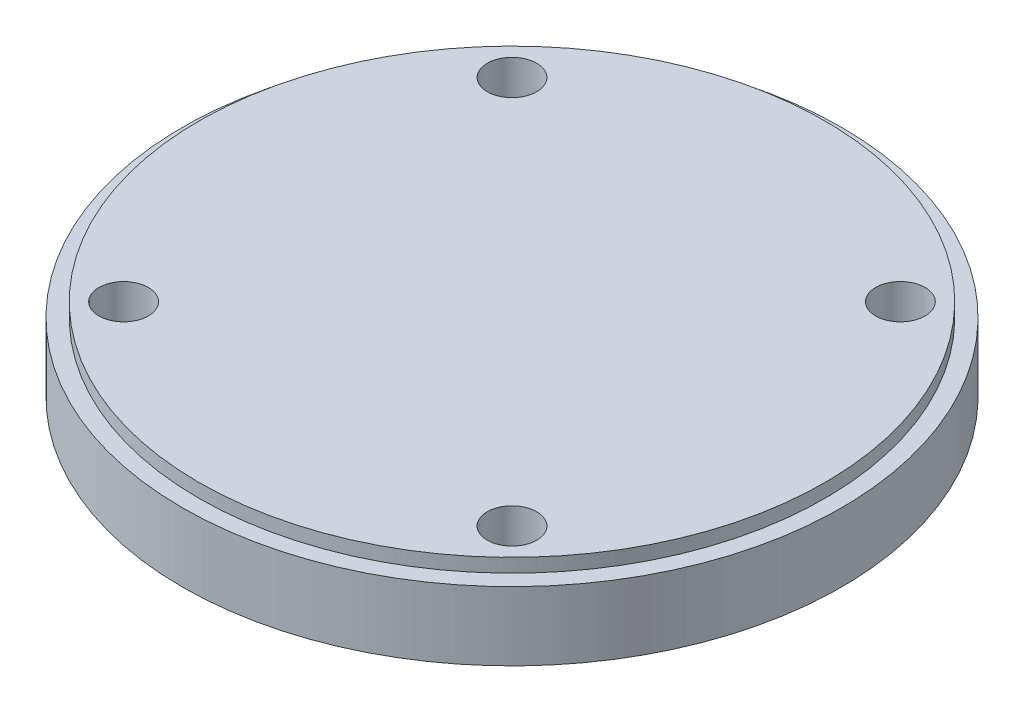
from build123d import *

# Parameters (mm, degrees)
SKETCH1_R            = 57
EXTRUDE4_DEPTH       = 7.5
EXTRUDE5_DEPTH       = 5
EXTRUDE5_DEPTH_BACK  = 7.5
SKETCH_R             = 60
SKETCH_R_2           = 57
M8_CLEARANCE_HOLE3_D = 9
CIRPATTERN1_COUNT    = 4


with BuildPart() as part:
    # Sketch1 → Extrude4 (new, symmetric)
    with BuildSketch(Plane(origin=(0, 0, 0), x_dir=(1, 0, 0), z_dir=(0, 1, 0))):
        with Locations(Location((0, 0, 0), (0, 0, 270))):
            Circle(SKETCH1_R)
    extrude(amount=EXTRUDE4_DEPTH, both=True)

    # Sketch → Extrude5 (add, two sides: drawn at the far end of the back side and taken through both)
    with BuildSketch(Plane(origin=(0, 0, 0), x_dir=(1, 0, 0), z_dir=(0, 1, 0)).offset(-EXTRUDE5_DEPTH_BACK)):
        with Locations(Location((0, 0, 0), (0, 0, 270))):
            Circle(SKETCH_R)
        with Locations(Location((0, 0, 0), (0, 0, 270))):
            Circle(SKETCH_R_2, mode=Mode.SUBTRACT)
    extrude(amount=EXTRUDE5_DEPTH + EXTRUDE5_DEPTH_BACK)

    # M8 Clearance Hole3 (through all)
    with Locations(Plane(origin=(0, 7.5, 0), x_dir=(1, 0, 0), z_dir=(0, 1, 0))):
        with Locations((-35.355339059, -35.355339059)):
            m8_clearance_hole3 = Hole(M8_CLEARANCE_HOLE3_D / 2)

    # CirPattern1: M8 Clearance Hole3 ×4 about axis
    cirpattern1_axis = Axis((0, 0, 0), (0, 1, 0))
    for i in range(1, CIRPATTERN1_COUNT):
        add(m8_clearance_hole3.rotate(cirpattern1_axis, i * 360 / CIRPATTERN1_COUNT), mode=Mode.SUBTRACT)


solid = part.part
